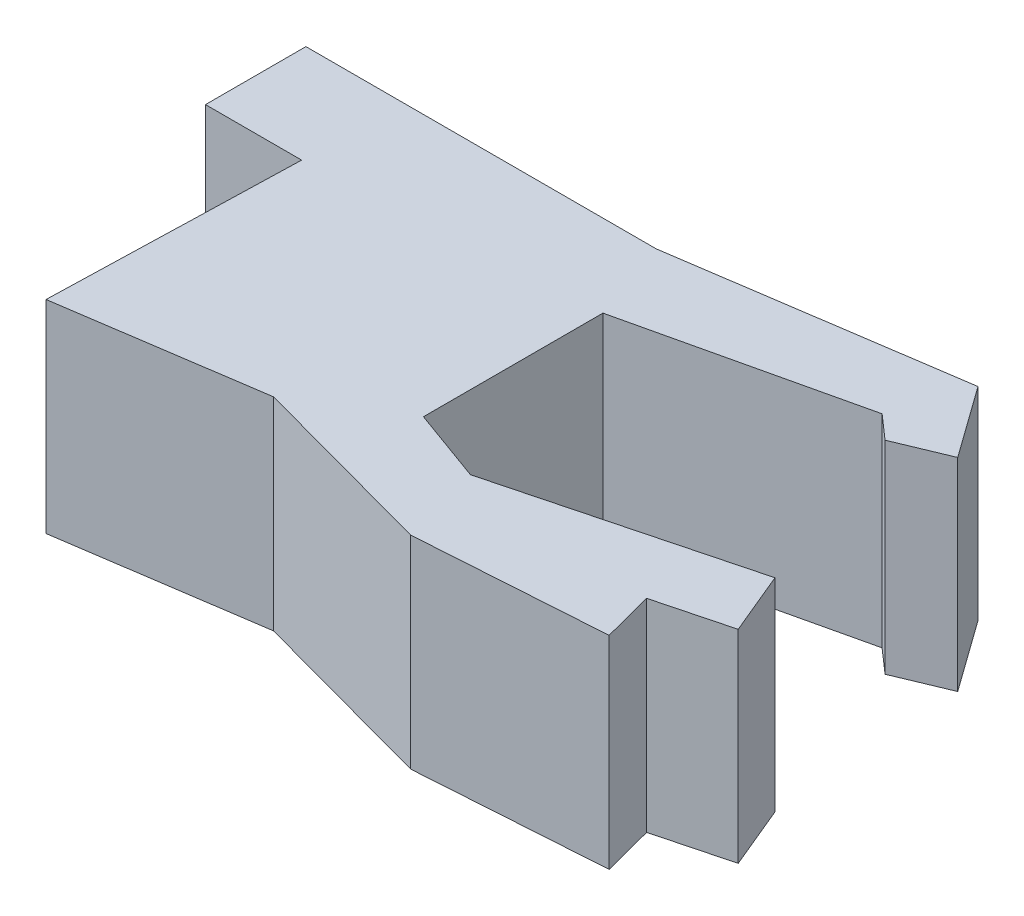
from build123d import *

# Parameters (mm, degrees)
EXTRUDE_1_DEPTH = 30


with BuildPart() as part:
    # 草图2 → 凸台-拉伸1 (new body)
    with BuildSketch(Plane(origin=(0, 0, 0), x_dir=(1, 0, 0), z_dir=(0, 1, 0))):
        Polygon((-120.893012342, 54.855588763), (-69.02724203, 54.855588763), (-27.597876721, 61.022555355), (-20.007763992, 50.428023005), (-27.597876721, 47.265476035), (-31.196921059, 50.428023005), (-64.757803621, 42.679782928), (-64.757803621, 16.114388378), (-53.847016573, 12.161204665), (-18.11023581, 21.490718228), (-14.222938492, 12.161204665), (-24.968689401, 9.355898012), (-23.005624562, 1.836361512), (-50.526342255, 0), (-78.400913929, 7.574557161), (-107.713879476, 3.211176794), (-106.661550976, 39.991618003), (-120.893012342, 39.991618003), align=None)
    extrude(amount=EXTRUDE_1_DEPTH)


solid = part.part
